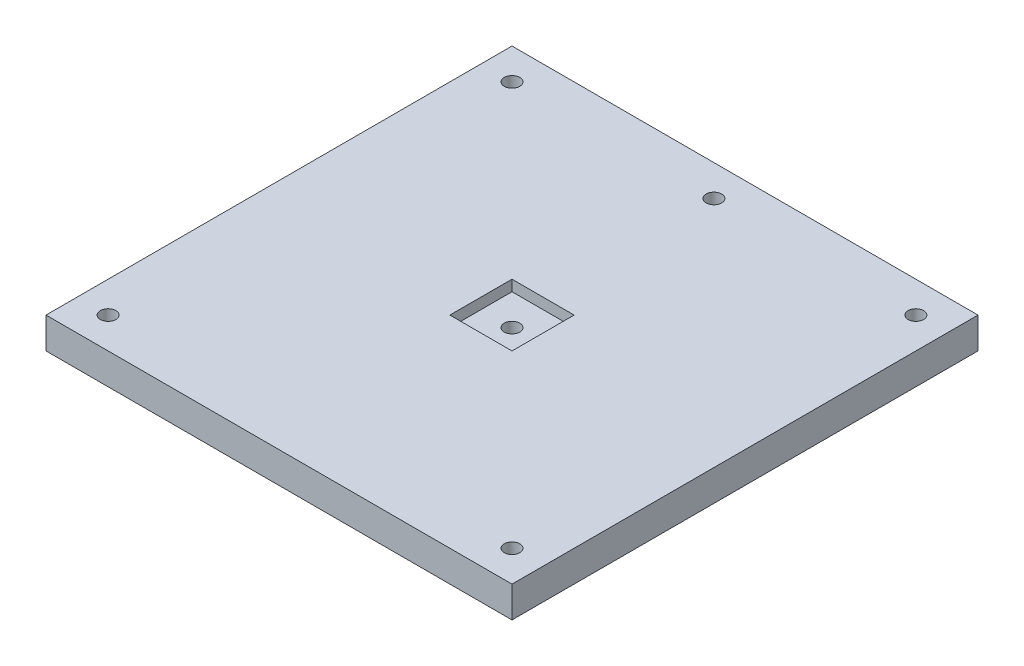
from build123d import *

# Parameters (mm, degrees)
ESBO_O1_W                = 300
ESBO_O1_H                = 300
ESBO_O1_R                = 5
RESSALTO_EXTRUS_O1_DEPTH = 20
ESBO_O2_W                = 40
ESBO_O2_H                = 40
CORTE_EXTRUS_O1_DEPTH    = 7
ESBO_O3_R                = 5
CORTE_EXTRUS_O2_DEPTH    = 397.948721879


with BuildPart() as part:
    # Esboço1 → Ressalto-extrusão1 (new body)
    with BuildSketch(Plane(origin=(0, 0, 0), x_dir=(1, 0, 0), z_dir=(0, 1, 0))):
        with Locations((124.594594595, -136.351351351)):
            Rectangle(ESBO_O1_W, ESBO_O1_H)
        with Locations(Location((-5.405405405, -6.351351351, 0), (0, 0, 270))):
            Circle(ESBO_O1_R, mode=Mode.SUBTRACT)
        with Locations(Location((254.594594595, -6.351351351, 0), (0, 0, 90))):
            Circle(ESBO_O1_R, mode=Mode.SUBTRACT)
        with Locations(Location((254.594594595, -266.351351351, 0), (0, 0, 270))):
            Circle(ESBO_O1_R, mode=Mode.SUBTRACT)
        with Locations(Location((-5.405405405, -266.351351351, 0), (0, 0, 90))):
            Circle(ESBO_O1_R, mode=Mode.SUBTRACT)
        with Locations(Location((124.594594595, -6.351351351, 0), (0, 0, 90))):
            Circle(ESBO_O1_R, mode=Mode.SUBTRACT)
    extrude(amount=RESSALTO_EXTRUS_O1_DEPTH)

    # Esboço2 → Corte-extrusão1 (cut)
    with BuildSketch(Plane(origin=(0, 20, 0), x_dir=(1, 0, 0), z_dir=(0, 1, 0))):
        with Locations((124.594594595, -136.351351351)):
            Rectangle(ESBO_O2_W, ESBO_O2_H)
    extrude(amount=-CORTE_EXTRUS_O1_DEPTH, mode=Mode.SUBTRACT)

    # Esboço3 → Corte-extrusão2 (cut, through all)
    with BuildSketch(Plane(origin=(0, 13, 0), x_dir=(1, 0, 0), z_dir=(0, 1, 0))):
        with Locations(Location((124.594594595, -136.351351351, 0), (0, 0, 270))):
            Circle(ESBO_O3_R)
    extrude(amount=-CORTE_EXTRUS_O2_DEPTH, mode=Mode.SUBTRACT)


solid = part.part
